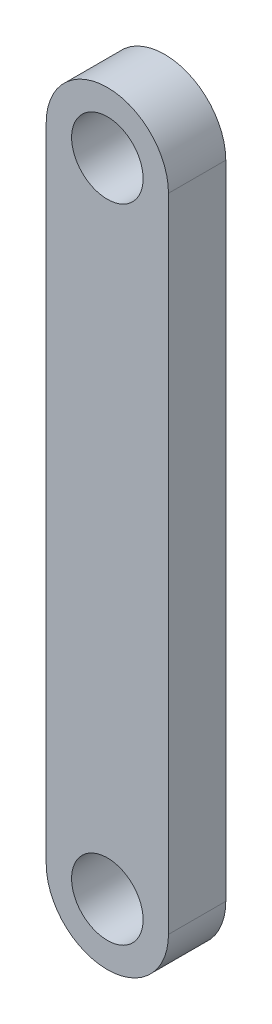
from build123d import *

# Parameters (mm, degrees)
SKETCH1_R           = 1.872
BOSS_EXTRUDE1_DEPTH = 3


with BuildPart() as part:
    # Sketch1 → Boss-Extrude1 (new body)
    with BuildSketch(Plane.XY):
        with BuildLine():
            Line((-3.2, 33.6), (-3.2, 0))
            ThreePointArc((-3.2, 0), (0, -3.2), (3.2, 0))
            Line((3.2, 0), (3.2, 33.6))
            ThreePointArc((3.2, 33.6), (0, 36.8), (-3.2, 33.6))
        make_face()
        Circle(SKETCH1_R, mode=Mode.SUBTRACT)
        with Locations((0, 33.6)):
            Circle(SKETCH1_R, mode=Mode.SUBTRACT)
    extrude(amount=BOSS_EXTRUDE1_DEPTH)


solid = part.part
